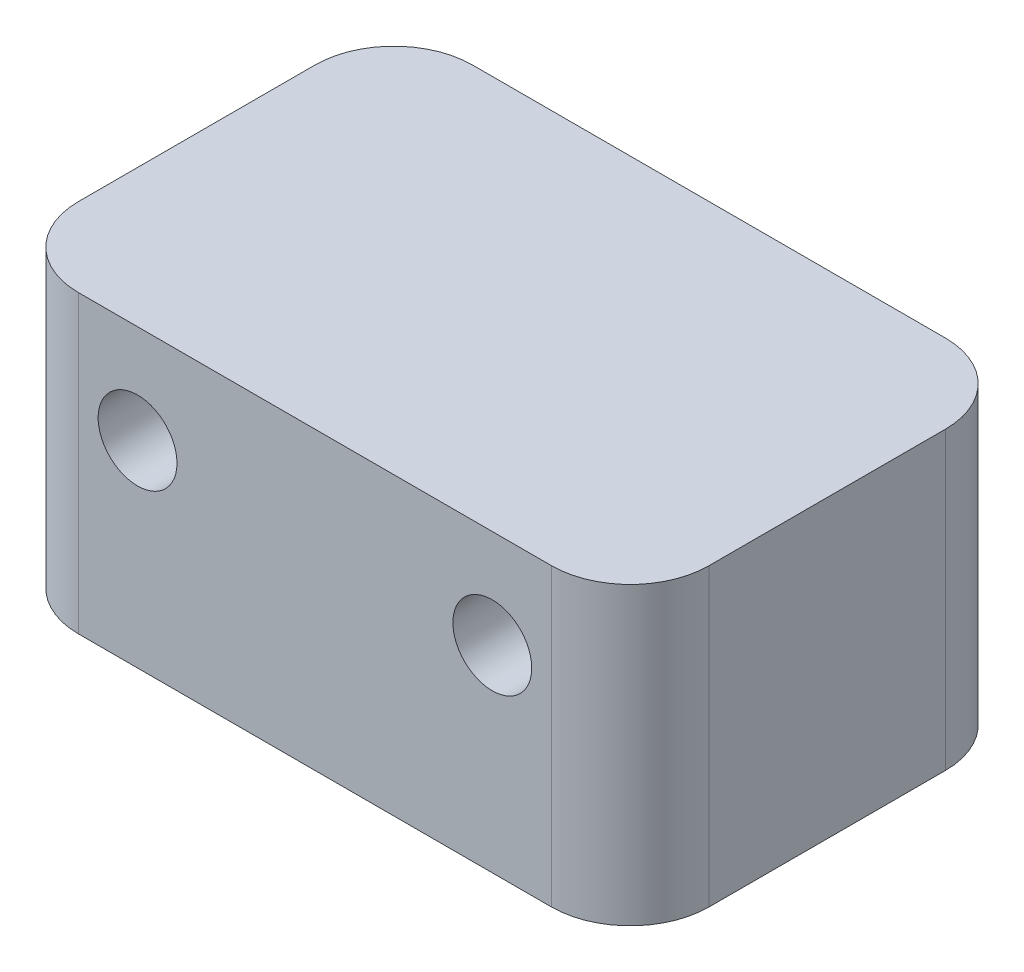
from build123d import *

# Parameters (mm, degrees)
BOSS_EXTRU_1_DEPTH      = 15
CONG_1_R                = 4
ESQUISSE2_R             = 2
ENL_V_MAT_EXTRU_1_DEPTH = 12
ESQUISSE3_R             = 2
ENL_V_MAT_EXTRU_2_DEPTH = 12


with BuildPart() as part:
    # Esquisse1 → Boss.-Extru.1 (new body)
    with BuildSketch(Plane(origin=(0, 0, 0), x_dir=(1, 0, 0), z_dir=(0, 1, 0))):
        Polygon((0, 0), (16, 0), (16, 20), (-16, 20), (-16, 0), align=None)
    extrude(amount=BOSS_EXTRU_1_DEPTH)

    # Congé1
    cong_1_edges = [part.edges().sort_by_distance(p)[0] for p in [
        (-16, 7.5, 0),
        (-16, 7.5, -20),
        (16, 7.5, -20),
        (16, 7.5, 0),
    ]]
    fillet(cong_1_edges, radius=CONG_1_R)

    # Esquisse2 → Enlèv. mat.-Extru.1 (cut)
    with BuildSketch(Plane.XZ):
        with Locations(Location((-10, -15, 0), (0, 0, 270))):
            Circle(ESQUISSE2_R)
        with Locations(Location((10, -15, 0), (0, 0, 270))):
            Circle(ESQUISSE2_R)
        with Locations(Location((0, -5, 0), (0, 0, 270))):
            Circle(ESQUISSE2_R)
    extrude(amount=-ENL_V_MAT_EXTRU_1_DEPTH, mode=Mode.SUBTRACT)

    # Esquisse3 → Enlèv. mat.-Extru.2 (cut)
    with BuildSketch(Plane.XY):
        with Locations((-9, 10)):
            Circle(ESQUISSE3_R)
        with Locations((9, 10)):
            Circle(ESQUISSE3_R)
    extrude(amount=-ENL_V_MAT_EXTRU_2_DEPTH, mode=Mode.SUBTRACT)


solid = part.part
